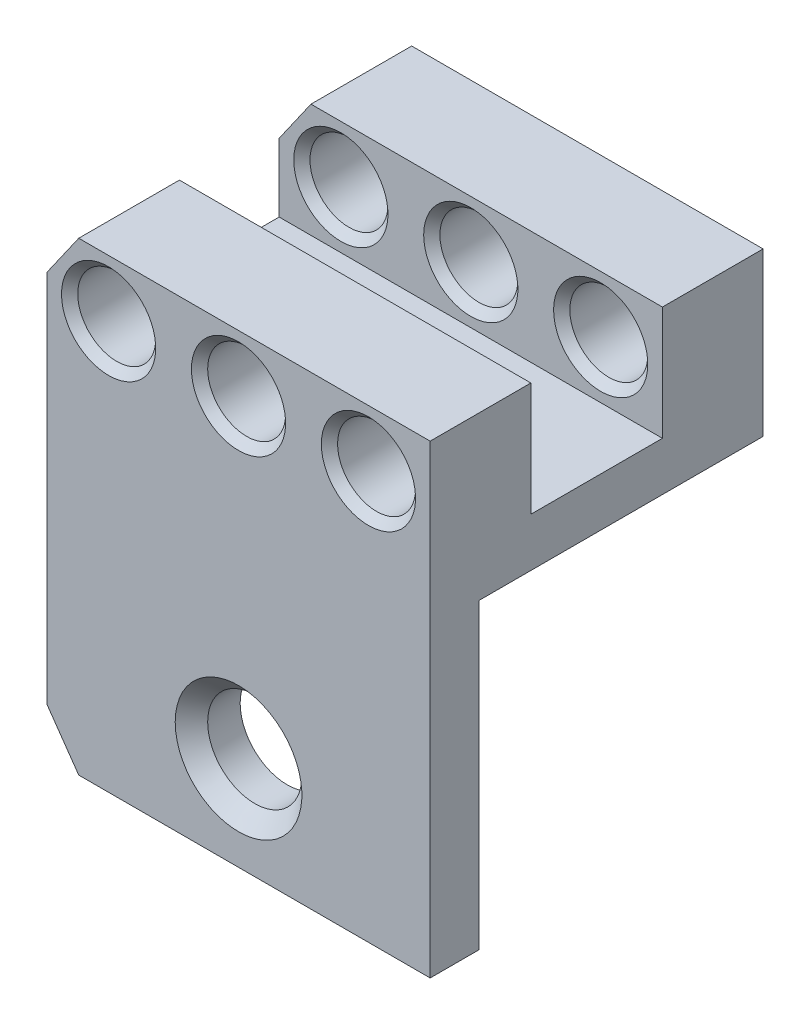
from build123d import *

# Parameters (mm, degrees)
SKETCH1_R           = 2.9
BOSS_EXTRUDE1_DEPTH = 3
SKETCH2_W           = 23.6
SKETCH2_H           = 20.5
BOSS_EXTRUDE2_DEPTH = 3
SKETCH3_W           = 23.6
SKETCH3_H           = 6.2
BOSS_EXTRUDE3_DEPTH = 7
SKETCH4_R           = 2.4
CUT_EXTRUDE2_DEPTH  = 37.390148045
CHAMFER1_SIZE       = 2.8
CHAMFER1_SIZE2      = 1.960581107
CHAMFER2_SIZE       = 1
CHAMFER3_SIZE       = 0.5


with BuildPart() as part:
    # Sketch1 → Boss-Extrude1 (new body)
    with BuildSketch(Plane.XY):
        Polygon((0, 0), (-23.6, 0), (-23.6, -14.4), (-23.6, -18.628818394), (-19.3, -18.628818394), (-4.3, -18.628818394), (0, -18.628818394), (0, -14.256438623), align=None)
        with Locations((-11.8, -12.828818394)):
            Circle(SKETCH1_R, mode=Mode.SUBTRACT)
    extrude(amount=BOSS_EXTRUDE1_DEPTH)

    # Sketch2 → Boss-Extrude2 (add)
    with BuildSketch(Plane(origin=(0, 0, 0), x_dir=(1, 0, 0), z_dir=(0, 1, 0))):
        with Locations((-11.8, 7.25)):
            Rectangle(SKETCH2_W, SKETCH2_H)
    extrude(amount=BOSS_EXTRUDE2_DEPTH)

    # Sketch3 → Boss-Extrude3 (add)
    with BuildSketch(Plane(origin=(0, 3, 0), x_dir=(1, 0, 0), z_dir=(0, 1, 0))):
        with Locations((-11.8, 0.1)):
            Rectangle(SKETCH3_W, SKETCH3_H)
        with Locations((-11.8, 14.4)):
            Rectangle(SKETCH3_W, SKETCH3_H)
    extrude(amount=BOSS_EXTRUDE3_DEPTH)

    # Sketch4 → Cut-Extrude2 (cut, through all)
    with BuildSketch(Plane.XY.offset(3)):
        with Locations((-11.8, 6.5)):
            Circle(SKETCH4_R)
        with Locations((-19.8, 6.5)):
            Circle(SKETCH4_R)
        with Locations((-3.8, 6.5)):
            Circle(SKETCH4_R)
    extrude(amount=-CUT_EXTRUDE2_DEPTH, mode=Mode.SUBTRACT)

    # Chamfer1
    chamfer1_edges = [part.edges().sort_by_distance(p)[0] for p in [
        (-23.6, -18.628818394, 1.5),
        (-23.6, 10, -0.1),
        (-23.6, 10, -14.4),
    ]]
    chamfer1_side = [part.faces().sort_by_distance(p)[0] for p in [
        (-23.6, 0.665571513, -4.855098328),
    ]]
    chamfer(chamfer1_edges, length=CHAMFER1_SIZE, length2=CHAMFER1_SIZE2, reference=chamfer1_side[0])

    # Chamfer2
    chamfer2_edges = [part.edges().sort_by_distance(p)[0] for p in [
        (-14.7, -12.828818394, 3),
    ]]
    chamfer(chamfer2_edges, length=CHAMFER2_SIZE)

    # Chamfer3
    chamfer3_edges = [part.edges().sort_by_distance(p)[0] for p in [
        (-6.2, 6.5, -3.2),
        (-6.2, 6.5, -17.5),
        (-6.2, 6.5, -11.3),
        (-6.2, 6.5, 3),
        (-22.2, 6.5, -3.2),
        (-22.2, 6.5, -17.5),
        (-22.2, 6.5, -11.3),
        (-22.2, 6.5, 3),
        (-14.2, 6.5, -3.2),
        (-14.2, 6.5, -17.5),
        (-14.2, 6.5, -11.3),
        (-14.2, 6.5, 3),
    ]]
    chamfer(chamfer3_edges, length=CHAMFER3_SIZE)


solid = part.part
